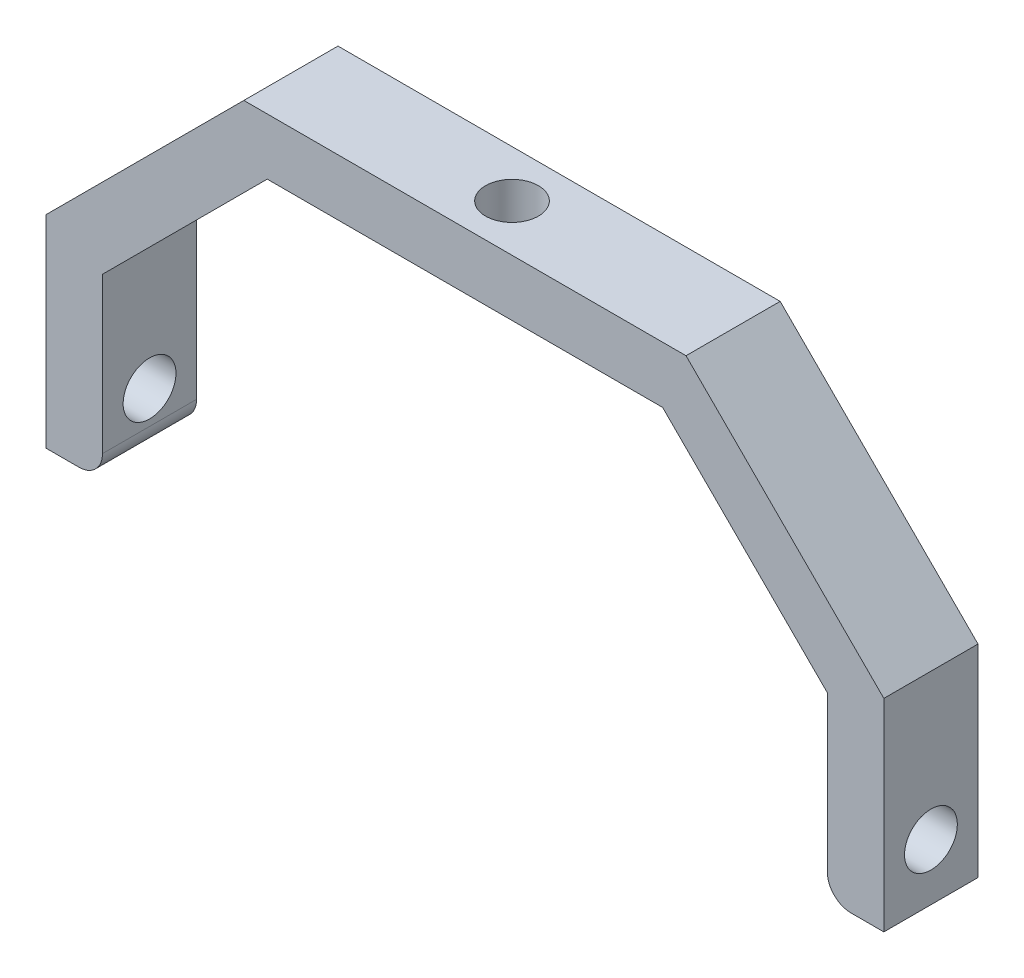
from build123d import *

# Parameters (mm, degrees)
BOSS_EXTRUDE1_DEPTH = 10
SKETCH3_R           = 2.8067
CUT_EXTRUDE1_DEPTH  = 59.416607228
FILLET1_R           = 2.5
CIRPATTERN3_COUNT   = 3
CIRPATTERN3_ANGLE   = 180


with BuildPart() as part:
    # Sketch1 → Boss-Extrude1 (new body)
    with BuildSketch(Plane.XY):
        Polygon((-44.5, -6), (-38.5, -6), (-38.5, 13), (-21, 30.5), (21, 30.5), (38.5, 13), (38.5, -6), (44.5, -6), (44.5, 15.485281374), (23.485281374, 36.5), (-23.485281374, 36.5), (-44.5, 15.485281374), align=None)
    extrude(amount=BOSS_EXTRUDE1_DEPTH)

    # Sketch3 → Cut-Extrude1 (cut, through all)
    with BuildSketch(Plane(origin=(0, 0, 0), x_dir=(0, 0, -1), z_dir=(1, 0, 0))):
        with Locations((-5, 0)):
            Circle(SKETCH3_R)
    cut_extrude1 = extrude(amount=CUT_EXTRUDE1_DEPTH, mode=Mode.SUBTRACT)

    # Fillet1
    fillet1_edges = [part.edges().sort_by_distance(p)[0] for p in [
        (38.5, -6, 5),
        (-38.5, -6, 5),
    ]]
    fillet(fillet1_edges, radius=FILLET1_R)

    # CirPattern3: Cut-Extrude1 ×3 about axis
    cirpattern3_axis = Axis((0, 0, 0), (0, 0, 1))
    for i in range(1, CIRPATTERN3_COUNT):
        add(cut_extrude1.rotate(cirpattern3_axis, i * CIRPATTERN3_ANGLE / (CIRPATTERN3_COUNT - 1)), mode=Mode.SUBTRACT)


solid = part.part
